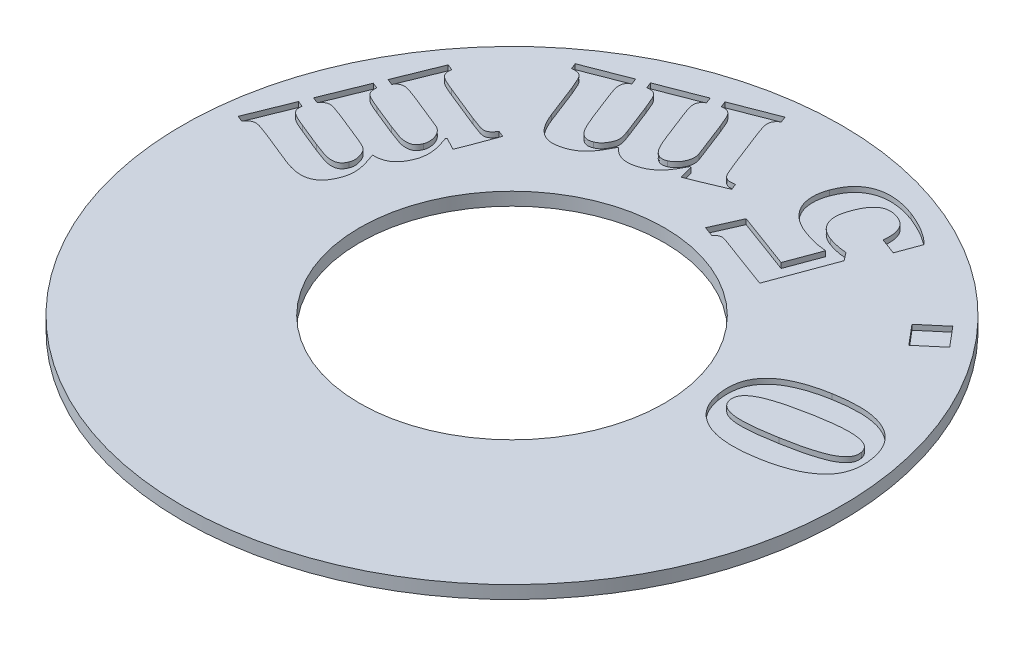
from build123d import *

# Parameters (mm, degrees)
SKETCH1_R           = 12.7
BOSS_EXTRUDE1_DEPTH = 0.5
SKETCH2_R           = 5.8674
CUT_EXTRUDE1_DEPTH  = 18.967470607
CUT_EXTRUDE2_DEPTH  = 0.2


with BuildPart() as part:
    # Sketch1 → Boss-Extrude1 (new body)
    with BuildSketch(Plane(origin=(0, 0, 0), x_dir=(1, 0, 0), z_dir=(0, 1, 0))):
        with Locations(Location((0, 0, 0), (0, 0, 270))):
            Circle(SKETCH1_R)
    extrude(amount=BOSS_EXTRUDE1_DEPTH)

    # Sketch2 → Cut-Extrude1 (cut, through all)
    with BuildSketch(Plane(origin=(0, 0, 0), x_dir=(-1, 0, 0), z_dir=(0, -1, 0))):
        with Locations(Location((0, 0, 0), (0, 0, 90))):
            Circle(SKETCH2_R)
    extrude(amount=-CUT_EXTRUDE1_DEPTH, mode=Mode.SUBTRACT)

    # Sketch4 → Cut-Extrude2 (cut)
    # profile 1 of 5: a face of its own
    with BuildSketch(Plane(origin=(0, 0.5, 0), x_dir=(1, 0, 0), z_dir=(0, 1, 0))):
        with BuildLine():
            add(Edge.make_bspline(
                [(11.714406882, 2.179505208), (11.721984598, 2.132914268), (11.736908331, 2.041156981), (11.74866318, 1.904864997), (11.752357826, 1.773036451), (11.746695803, 1.645600384), (11.733179819, 1.522296204), (11.707876126, 1.403581433), (11.676714797, 1.28899405), (11.635405668, 1.178658558), (11.584646929, 1.072709619), (11.523881673, 0.970485095), (11.450986751, 0.873052683), (11.368678714, 0.778083972), (11.274465946, 0.687951638), (11.170133167, 0.601476878), (11.055210203, 0.519203927), (10.930428021, 0.43948966), (10.794467406, 0.364166051), (10.646314632, 0.29538558), (10.487102545, 0.230047996), (10.316218188, 0.16993316), (10.134333462, 0.113455876), (9.940675548, 0.063162279), (9.735895278, 0.016742244), (9.594894738, -0.009651177), (9.522774937, -0.023151042)],
                knots=[0, 0, 0, 0, 0.958609587, 1.887908131, 2.776528707, 3.635817958, 4.477514347, 5.292981102, 6.098962166, 6.887927691, 7.682593858, 8.482745968, 9.299441865, 10.151273195, 11.03293693, 11.944771076, 12.90195535, 13.902185533, 14.951360626, 16.056714254, 17.218407893, 18.446172401, 19.735398079, 21.086155649, 22.509609453, 24, 24, 24, 24], degree=3))
            add(Edge.make_bspline(
                [(9.522774937, -0.023151042), (9.454127441, -0.034645174), (9.319705933, -0.05715231), (9.12075356, -0.082313288), (8.928870131, -0.100575903), (8.743451731, -0.10917171), (8.565078925, -0.110415714), (8.393576185, -0.104321059), (8.229124035, -0.088644407), (8.071591119, -0.065721648), (7.920831055, -0.035182887), (7.778159776, 0.00463669), (7.642571789, 0.051083117), (7.514219242, 0.104586405), (7.394291447, 0.168004545), (7.280576129, 0.23747752), (7.175347658, 0.315612752), (7.077398468, 0.400919375), (6.98835329, 0.493963148), (6.905829407, 0.592845125), (6.834554273, 0.700823489), (6.770493783, 0.814664857), (6.713621981, 0.934727323), (6.668112162, 1.062488935), (6.628452618, 1.196237051), (6.610486777, 1.288925244), (6.601333965, 1.336145833)],
                knots=[0, 0, 0, 0, 1.377081801, 2.696520979, 3.967029936, 5.189958886, 6.367899492, 7.495764028, 8.58392972, 9.634848915, 10.644458858, 11.625276047, 12.563445176, 13.479055366, 14.373430196, 15.245143787, 16.113332587, 16.963553947, 17.81203241, 18.65923255, 19.508240485, 20.36773861, 21.24275135, 22.132948981, 23.048818972, 24, 24, 24, 24], degree=3))
            add(Edge.make_bspline(
                [(6.601333965, 1.336145833), (6.590374917, 1.409119309), (6.569088165, 1.550862297), (6.561219532, 1.760415475), (6.575293668, 1.958953541), (6.610358421, 2.147139956), (6.667456922, 2.324628611), (6.748320425, 2.490485464), (6.849085657, 2.646203705), (6.972869034, 2.79037078), (7.119030215, 2.923495287), (7.287908697, 3.046015147), (7.479575957, 3.15799777), (7.692999529, 3.260534562), (7.929473846, 3.351911703), (8.188606749, 3.432493305), (8.469955143, 3.504792325), (8.666309681, 3.541772454), (8.767610007, 3.560850694)],
                knots=[0, 0, 0, 0, 0.999567856, 1.941551137, 2.835430862, 3.692112604, 4.530042397, 5.354256606, 6.185901446, 7.037296772, 7.922125271, 8.859554852, 9.859817352, 10.926857119, 12.065428116, 13.292532894, 14.603203662, 16, 16, 16, 16], degree=3))
            add(Edge.make_bspline(
                [(8.767610007, 3.560850694), (8.872556173, 3.578089573), (9.075950462, 3.611499934), (9.374044021, 3.642534882), (9.654962104, 3.655480481), (9.919104507, 3.649083388), (10.16646075, 3.625396611), (10.396947804, 3.584262386), (10.610223933, 3.523655106), (10.806244942, 3.444326865), (10.984715177, 3.347232526), (11.145299598, 3.232771229), (11.287704723, 3.100868546), (11.410870941, 2.950264084), (11.516398778, 2.782666511), (11.602055143, 2.597212453), (11.670170403, 2.3949462), (11.699387738, 2.252651608), (11.714406882, 2.179505208)],
                knots=[0, 0, 0, 0, 1.382354807, 2.679117153, 3.893664334, 5.035775843, 6.111018257, 7.121123013, 8.075237234, 8.98808331, 9.864605882, 10.710386895, 11.545304963, 12.380236698, 13.232482408, 14.113005489, 15.02999227, 16, 16, 16, 16], degree=3))
        make_face()
        with BuildLine():
            add(Edge.make_bspline(
                [(9.219606535, 1.068255208), (9.284683323, 1.079829663), (9.411704072, 1.102421373), (9.596640597, 1.138497503), (9.770534016, 1.176660884), (9.934053566, 1.212252427), (10.086559049, 1.249921426), (10.228376129, 1.288387015), (10.35990895, 1.327142151), (10.481497289, 1.365270741), (10.593486227, 1.40541221), (10.697010143, 1.445743704), (10.79215177, 1.48792763), (10.87901414, 1.530180936), (10.957341787, 1.574928103), (11.027127581, 1.620793229), (11.089596263, 1.666885144), (11.158879658, 1.728964171), (11.22971171, 1.810928632), (11.284648099, 1.922689244), (11.309871915, 2.043155021), (11.300339469, 2.123992073), (11.295483271, 2.165173611)],
                knots=[0, 0, 0, 0, 1.557617706, 3.040250939, 4.439806625, 5.752917555, 6.983694298, 8.141184335, 9.215338113, 10.214963335, 11.143493169, 12.018295842, 12.832493275, 13.595433329, 14.293601868, 14.956508562, 15.562688609, 16.120753321, 17.14746835, 18.092449204, 19.02821946, 20, 20, 20, 20], degree=3))
            add(Edge.make_bspline(
                [(11.295483271, 2.165173611), (11.290630428, 2.187423295), (11.281129519, 2.230983781), (11.255962542, 2.291754108), (11.225759764, 2.348181119), (11.184496682, 2.39690216), (11.137027399, 2.441883073), (11.0791213, 2.480383085), (11.013344364, 2.515872768), (10.937047568, 2.544976214), (10.851936991, 2.572052153), (10.75519068, 2.592541648), (10.647257078, 2.607613076), (10.527627319, 2.617369926), (10.395573233, 2.621273708), (10.249846914, 2.620975218), (10.090001592, 2.60947772), (9.916856706, 2.594438819), (9.731964111, 2.573380479), (9.53727306, 2.546553163), (9.33246291, 2.515932739), (9.193101759, 2.491778247), (9.121490215, 2.479366319)],
                knots=[0, 0, 0, 0, 0.572229672, 1.120312679, 1.650532829, 2.176538382, 2.719915381, 3.292219849, 3.921383417, 4.598328246, 5.344567867, 6.168499634, 7.084441038, 8.087164471, 9.188822549, 10.410175109, 11.7543557, 13.221963368, 14.786276719, 16.438938668, 18.170127758, 20, 20, 20, 20], degree=3))
            add(Edge.make_bspline(
                [(9.121490215, 2.479366319), (9.017037789, 2.459976007), (8.816564112, 2.422760526), (8.530215213, 2.362148612), (8.270747284, 2.301187922), (8.038791019, 2.23725447), (7.833636719, 2.172384552), (7.654402583, 2.108053279), (7.501513369, 2.042603377), (7.374408119, 1.975163143), (7.26992064, 1.906849976), (7.183532145, 1.838824888), (7.115875961, 1.768140381), (7.064031908, 1.69661103), (7.030638119, 1.621986877), (7.010354212, 1.545727996), (7.002907456, 1.466434944), (7.010030296, 1.413636803), (7.013642993, 1.386857639)],
                knots=[0, 0, 0, 0, 1.988775594, 3.817021521, 5.4789669, 6.977745736, 8.32016058, 9.506246951, 10.541465291, 11.430941948, 12.196080763, 12.876175374, 13.484416021, 14.022644376, 14.521394553, 15.005310829, 15.495494642, 16, 16, 16, 16], degree=3))
            add(Edge.make_bspline(
                [(7.013642993, 1.386857639), (7.020973001, 1.355992341), (7.03519293, 1.29611487), (7.075179093, 1.213190212), (7.129685771, 1.140706797), (7.200039193, 1.078925458), (7.285376056, 1.02810536), (7.385532945, 0.987763871), (7.500413136, 0.957375034), (7.629962099, 0.935883122), (7.775133078, 0.922664936), (7.93566621, 0.920645981), (8.111495262, 0.92477074), (8.302288999, 0.938796755), (8.508870696, 0.959906252), (8.731603074, 0.988816652), (8.970430894, 1.025365971), (9.134764463, 1.053651808), (9.219606535, 1.068255208)],
                knots=[0, 0, 0, 0, 0.626844687, 1.216054204, 1.808491308, 2.41169403, 3.058255876, 3.766476537, 4.543323699, 5.407210063, 6.364629713, 7.427452982, 8.585033063, 9.847165452, 11.215172558, 12.697471874, 14.294972063, 16, 16, 16, 16], degree=3))
        make_face(mode=Mode.SUBTRACT)
    # profile 2 of 5: a face of its own
    with BuildSketch(Plane(origin=(0, 0.5, 0), x_dir=(1, 0, 0), z_dir=(0, 1, 0))):
        Polygon((7.998334498, 7.413598887), (8.851615748, 8.134588471), (9.493230331, 7.375013818), (8.639949081, 6.654024235), align=None)
    # profile 3 of 5: a face of its own
    with BuildSketch(Plane(origin=(0, 0.5, 0), x_dir=(1, 0, 0), z_dir=(0, 1, 0))):
        with BuildLine():
            Line((5.574896811, 10.308708524), (5.254089519, 9.438890816))
            Line((5.254089519, 9.438890816), (4.624601672, 9.672606094))
            add(Edge.make_bspline(
                [(4.624601672, 9.672606094), (4.631387567, 9.737942532), (4.644258636, 9.861868691), (4.637340573, 10.040064116), (4.611721198, 10.199778948), (4.560455455, 10.340509304), (4.486390823, 10.462510654), (4.389225928, 10.565932844), (4.269388176, 10.651487965), (4.177198854, 10.690074646), (4.129610353, 10.709993246)],
                knots=[0, 0, 0, 0, 1.252087754, 2.37488346, 3.392886558, 4.326924804, 5.214503496, 6.097638712, 7.017993396, 8, 8, 8, 8], degree=3))
            add(Edge.make_bspline(
                [(4.129610353, 10.709993246), (4.098901443, 10.72044862), (4.038896756, 10.740878242), (3.948868043, 10.761728287), (3.862071012, 10.773376114), (3.778872751, 10.77419959), (3.699158905, 10.767154906), (3.622875935, 10.748924048), (3.549977688, 10.721659066), (3.480655486, 10.683136114), (3.414711854, 10.635505347), (3.35086418, 10.578828583), (3.291686432, 10.510651358), (3.234383561, 10.433147177), (3.178789408, 10.345815477), (3.128102715, 10.24739301), (3.077409419, 10.140176671), (3.048678803, 10.06383279), (3.03379438, 10.024281441)],
                knots=[0, 0, 0, 0, 1.049979466, 2.051641988, 2.987448877, 3.880037529, 4.740886302, 5.572193246, 6.412058797, 7.253524656, 8.131960202, 9.042144691, 10.011621459, 11.049323214, 12.161905286, 13.359627819, 14.632106724, 16, 16, 16, 16], degree=3))
            add(Edge.make_bspline(
                [(3.03379438, 10.024281441), (3.019988553, 9.984771964), (2.993269696, 9.908308016), (2.963679972, 9.793593111), (2.941875045, 9.684020754), (2.931992764, 9.578025516), (2.931638403, 9.476852983), (2.941653119, 9.379675485), (2.9611446, 9.287096326), (2.991388586, 9.199138012), (3.030624167, 9.116147643), (3.081492517, 9.039624557), (3.139875889, 8.967296797), (3.208480709, 8.901174761), (3.286972074, 8.841340457), (3.373734714, 8.786177956), (3.470821046, 8.737534397), (3.539591979, 8.71004246), (3.575087783, 8.695852621)],
                knots=[0, 0, 0, 0, 1.226162231, 2.373030824, 3.469373376, 4.497174898, 5.48808273, 6.430137497, 7.355418433, 8.254629872, 9.150674949, 10.037937929, 10.941268307, 11.870552641, 12.82277354, 13.829765479, 14.87984332, 16, 16, 16, 16], degree=3))
            add(Edge.make_bspline(
                [(3.575087783, 8.695852621), (3.634660591, 8.675253181), (3.758475735, 8.632439643), (3.952102812, 8.589705806), (4.144627613, 8.556713866), (4.271367423, 8.544151157), (4.331355144, 8.538205052)],
                knots=[0, 0, 0, 0, 0.975653588, 2.02778234, 3.066521846, 4, 4, 4, 4], degree=3))
            Line((4.331355144, 8.538205052), (4.571685005, 8.227319635))
            Line((4.571685005, 8.227319635), (3.693047853, 5.851581788))
            Line((3.693047853, 5.851581788), (1.637014866, 6.612258871))
            add(Edge.make_bspline(
                [(1.637014866, 6.612258871), (1.616830245, 6.619313332), (1.579201403, 6.632464492), (1.526968323, 6.649546043), (1.481937633, 6.659966101), (1.433987476, 6.665787092), (1.380020191, 6.66387918), (1.330027678, 6.646510522), (1.29131885, 6.622255393), (1.258434576, 6.595218189), (1.221340263, 6.560128354), (1.196244375, 6.533046192), (1.182813478, 6.518552274)],
                knots=[0, 0, 0, 0, 1.253494046, 2.336805197, 3.220012507, 3.95747953, 5.165541251, 6.3509189, 7.00855668, 7.83615953, 8.841948909, 10, 10, 10, 10], degree=3))
            Line((1.182813478, 6.518552274), (0.800270075, 6.660765816))
            Line((0.800270075, 6.660765816), (1.279827366, 7.744455052))
            Line((1.279827366, 7.744455052), (3.416337783, 6.954012344))
            Line((3.416337783, 6.954012344), (3.880461047, 8.206373455))
            add(Edge.make_bspline(
                [(3.880461047, 8.206373455), (3.803522357, 8.213312916), (3.648813276, 8.227266854), (3.45543269, 8.262445033), (3.29601422, 8.302888221), (3.165244012, 8.339961342), (3.0234968, 8.386881328), (2.926024573, 8.422540568), (2.87504438, 8.441191163)],
                knots=[0, 0, 0, 0, 1.341269289, 2.697037574, 3.40753922, 4.197423952, 5.057211692, 6, 6, 6, 6], degree=3))
            add(Edge.make_bspline(
                [(2.87504438, 8.441191163), (2.806008698, 8.468730307), (2.671373454, 8.522437886), (2.48571203, 8.625979715), (2.319487782, 8.742871718), (2.175288875, 8.875907922), (2.053429011, 9.021833226), (1.957424292, 9.181291156), (1.884371252, 9.350819162), (1.840041077, 9.532181134), (1.819062593, 9.721085121), (1.830024493, 9.915670826), (1.862866112, 10.115632746), (1.90736191, 10.246016871), (1.930261394, 10.313118246)],
                knots=[0, 0, 0, 0, 1.128832902, 2.201480293, 3.222928609, 4.211197018, 5.175316162, 6.102663331, 7.031254653, 7.970138723, 8.930626153, 9.909201145, 10.923983423, 12, 12, 12, 12], degree=3))
            add(Edge.make_bspline(
                [(1.930261394, 10.313118246), (1.94559186, 10.352269578), (1.975609559, 10.428929537), (2.027687036, 10.538232056), (2.084130342, 10.64035564), (2.145134968, 10.735386069), (2.213764382, 10.82149829), (2.284294623, 10.902277804), (2.361510413, 10.974442059), (2.442800167, 11.039593247), (2.529429522, 11.096951368), (2.619555555, 11.147764157), (2.714368105, 11.191149212), (2.812820072, 11.22712116), (2.915529272, 11.256369019), (3.022148124, 11.277009639), (3.13308148, 11.289945675), (3.288001447, 11.299146839), (3.491355399, 11.289925868), (3.744705188, 11.254546034), (4.010669123, 11.189738457), (4.188521435, 11.12788308), (4.280643339, 11.095843941)],
                knots=[0, 0, 0, 0, 0.895391496, 1.753214336, 2.576597175, 3.37990413, 4.154990145, 4.920091058, 5.66210029, 6.402911233, 7.136700113, 7.872656764, 8.604690066, 9.355033743, 10.103374157, 10.877075559, 11.665446707, 12.480866022, 14.180599257, 15.990525543, 17.923218344, 20, 20, 20, 20], degree=3))
            add(Edge.make_bspline(
                [(4.280643339, 11.095843941), (4.341594005, 11.072715612), (4.464212067, 11.026186983), (4.643578069, 10.942026547), (4.822735187, 10.850900287), (4.997684924, 10.750565467), (5.164616911, 10.645565767), (5.317141244, 10.53639273), (5.453574886, 10.425289374), (5.535328424, 10.346730639), (5.574896811, 10.308708524)],
                knots=[0, 0, 0, 0, 1.025349981, 2.062757216, 3.115184705, 4.187311912, 5.234724667, 6.216692077, 7.136886078, 8, 8, 8, 8], degree=3))
        make_face()
    # profile 4 of 5: a face of its own
    with BuildSketch(Plane(origin=(0, 0.5, 0), x_dir=(1, 0, 0), z_dir=(0, 1, 0))):
        with BuildLine():
            Line((-1.500499582, 8.398806621), (-1.545699235, 8.394396899))
            add(Edge.make_bspline(
                [(-1.545699235, 8.394396899), (-1.578680129, 8.328177935), (-1.64156419, 8.201919461), (-1.744030648, 8.02884167), (-1.846044886, 7.880084841), (-1.949946333, 7.754727011), (-2.05857315, 7.650318657), (-2.17357881, 7.562688436), (-2.294646542, 7.48709386), (-2.38188138, 7.450331118), (-2.425438818, 7.431975024)],
                knots=[0, 0, 0, 0, 1.327248858, 2.530640849, 3.606312378, 4.561298934, 5.447501221, 6.30354898, 7.15294094, 8, 8, 8, 8], degree=3))
            add(Edge.make_bspline(
                [(-2.425438818, 7.431975024), (-2.466711164, 7.416501822), (-2.546064862, 7.386751738), (-2.664025189, 7.356362389), (-2.774202536, 7.336715383), (-2.877415506, 7.329477021), (-2.975012839, 7.335492968), (-3.068194376, 7.350780271), (-3.158059284, 7.376341345), (-3.244768044, 7.411813357), (-3.328951411, 7.458526601), (-3.408552551, 7.519497131), (-3.489562903, 7.588502591), (-3.538054885, 7.643001758), (-3.563147151, 7.671202454)],
                knots=[0, 0, 0, 0, 1.261849166, 2.426137807, 3.483538902, 4.464561663, 5.381899843, 6.278343648, 7.164718223, 8.052217243, 8.957088943, 9.91293841, 10.920046081, 12, 12, 12, 12], degree=3))
            add(Edge.make_bspline(
                [(-3.563147151, 7.671202454), (-3.599531182, 7.59843004), (-3.668389116, 7.460705936), (-3.777147706, 7.27123298), (-3.885029972, 7.111206789), (-3.99057811, 6.976050247), (-4.102053829, 6.86480688), (-4.219976724, 6.770641123), (-4.348199055, 6.69203994), (-4.439779694, 6.652578048), (-4.485881526, 6.632712871)],
                knots=[0, 0, 0, 0, 1.370148351, 2.593049264, 3.676206861, 4.618613109, 5.476374145, 6.322127868, 7.155356622, 8, 8, 8, 8], degree=3))
            add(Edge.make_bspline(
                [(-4.485881526, 6.632712871), (-4.530445251, 6.616076964), (-4.615952839, 6.584156465), (-4.743101562, 6.551526654), (-4.861772979, 6.530294812), (-4.973189572, 6.524827778), (-5.078684173, 6.531644554), (-5.178538203, 6.555233414), (-5.275449977, 6.587065021), (-5.366578661, 6.635862424), (-5.452894115, 6.696968271), (-5.534744327, 6.770753064), (-5.613569564, 6.855921676), (-5.687290851, 6.95508305), (-5.757960734, 7.067347228), (-5.826043906, 7.19293182), (-5.891036555, 7.332819596), (-5.93122393, 7.431428083), (-5.952114165, 7.482686829)],
                knots=[0, 0, 0, 0, 1.164238848, 2.233907847, 3.210467445, 4.111618036, 4.95998529, 5.789768502, 6.618037198, 7.451375979, 8.310370773, 9.20280479, 10.145472204, 11.148103074, 12.224265042, 13.392220349, 14.64442181, 16, 16, 16, 16], degree=3))
            Line((-5.952114165, 7.482686829), (-6.443798193, 8.752686829))
            add(Edge.make_bspline(
                [(-6.443798193, 8.752686829), (-6.46298886, 8.80204742), (-6.500138469, 8.897600464), (-6.557518406, 9.031550001), (-6.610596713, 9.14701544), (-6.6652213, 9.236719574), (-6.719195792, 9.30301382), (-6.776882541, 9.349899558), (-6.841998121, 9.381410269), (-6.91741995, 9.396764093), (-7.003583166, 9.400735532), (-7.06413052, 9.395102303), (-7.096437082, 9.392096552)],
                knots=[0, 0, 0, 0, 1.559140996, 3.018210822, 4.290952874, 5.296787436, 6.103062558, 6.795868098, 7.468525882, 8.211398264, 9.045646607, 10, 10, 10, 10], degree=3))
            Line((-7.096437082, 9.392096552), (-7.185733957, 9.621402107))
            Line((-7.185733957, 9.621402107), (-5.508937082, 10.271836135))
            Line((-5.508937082, 10.271836135), (-5.419640207, 10.042530579))
            add(Edge.make_bspline(
                [(-5.419640207, 10.042530579), (-5.44126826, 10.026399982), (-5.481650493, 9.996282175), (-5.533846741, 9.947929725), (-5.570951767, 9.898212078), (-5.594627254, 9.847372575), (-5.604920024, 9.794555745), (-5.609329846, 9.738344691), (-5.607052869, 9.676900081), (-5.596124222, 9.607106489), (-5.574701737, 9.523170129), (-5.540686924, 9.418742082), (-5.495430219, 9.289738424), (-5.459929128, 9.196145913), (-5.440586387, 9.145152107)],
                knots=[0, 0, 0, 0, 0.976263073, 1.822803084, 2.564919562, 3.207680077, 3.833713685, 4.500778585, 5.245986733, 6.052842077, 7.052732165, 8.377616694, 10.026347317, 12, 12, 12, 12], degree=3))
            Line((-5.440586387, 9.145152107), (-5.077886735, 8.212495857))
            add(Edge.make_bspline(
                [(-5.077886735, 8.212495857), (-5.058213378, 8.162818328), (-5.020773209, 8.068277516), (-4.964958774, 7.935032266), (-4.911566849, 7.817607376), (-4.862407323, 7.714442109), (-4.814206633, 7.625009471), (-4.764214553, 7.549826783), (-4.714948421, 7.485912263), (-4.663879121, 7.434812521), (-4.612373766, 7.394089192), (-4.560879865, 7.363706829), (-4.510177119, 7.340304693), (-4.45834347, 7.326789669), (-4.404290481, 7.322415505), (-4.347102358, 7.327322637), (-4.286499427, 7.340839251), (-4.245784961, 7.355102318), (-4.224605485, 7.362521899)],
                knots=[0, 0, 0, 0, 1.886072366, 3.589365554, 5.098767554, 6.438935382, 7.62327005, 8.680997452, 9.623029443, 10.466885591, 11.224590498, 11.934248244, 12.573028465, 13.189694188, 13.814492117, 14.478078476, 15.208303495, 16, 16, 16, 16], degree=3))
            add(Edge.make_bspline(
                [(-4.224605485, 7.362521899), (-4.196124879, 7.375107043), (-4.140617846, 7.399634753), (-4.06647594, 7.453951996), (-4.002096369, 7.521299194), (-3.946506985, 7.600529328), (-3.897145713, 7.683379182), (-3.857845601, 7.766968153), (-3.829112457, 7.850147785), (-3.819086508, 7.936966256), (-3.820853325, 8.026934807), (-3.836167036, 8.105507556), (-3.855045624, 8.176985637), (-3.877649694, 8.244743013), (-3.906253353, 8.326857924), (-3.92895999, 8.385647919), (-3.941280832, 8.41754794)],
                knots=[0, 0, 0, 0, 1.05712718, 2.060278967, 3.103930472, 4.214663213, 5.347149753, 6.382223774, 7.355140304, 8.326206341, 9.339519046, 10.406659634, 11.040664636, 11.855394827, 12.836316401, 14, 14, 14, 14], degree=3))
            Line((-3.941280832, 8.41754794), (-4.381150624, 9.551948982))
            add(Edge.make_bspline(
                [(-4.381150624, 9.551948982), (-4.395843684, 9.589066049), (-4.42322045, 9.65822422), (-4.461713942, 9.755215287), (-4.496936471, 9.837422587), (-4.535923805, 9.924848545), (-4.581174005, 10.013011645), (-4.639853073, 10.097027896), (-4.70584835, 10.158300648), (-4.770957186, 10.189348355), (-4.82925529, 10.203846904), (-4.881158179, 10.209027832), (-4.940539071, 10.208514609), (-4.982726237, 10.205229651), (-5.005126318, 10.20348544)],
                knots=[0, 0, 0, 0, 1.43593228, 2.675492938, 3.753329024, 4.652559938, 6.11901344, 7.311444819, 8.322447917, 9.321542641, 9.866545793, 10.478167495, 11.191953967, 12, 12, 12, 12], degree=3))
            Line((-5.005126318, 10.20348544), (-5.094423193, 10.432790996))
            Line((-5.094423193, 10.432790996), (-3.438572499, 11.074405579))
            Line((-3.438572499, 11.074405579), (-3.349275624, 10.845100024))
            add(Edge.make_bspline(
                [(-3.349275624, 10.845100024), (-3.371829284, 10.829185098), (-3.413734166, 10.799615038), (-3.465251913, 10.749034653), (-3.503876703, 10.69980329), (-3.528520914, 10.648919497), (-3.540482433, 10.595811986), (-3.544340482, 10.539416273), (-3.542185737, 10.47838512), (-3.531505961, 10.409501208), (-3.508063178, 10.326746257), (-3.474739068, 10.222065038), (-3.429638126, 10.092106636), (-3.393324208, 9.997946719), (-3.373529096, 9.946619121)],
                knots=[0, 0, 0, 0, 0.992957471, 1.844922954, 2.591631667, 3.237113429, 3.86329802, 4.54058269, 5.269232777, 6.059395145, 7.045266299, 8.364235463, 10.018105088, 12, 12, 12, 12], degree=3))
            Line((-3.373529096, 9.946619121), (-3.010829443, 9.013962871))
            add(Edge.make_bspline(
                [(-3.010829443, 9.013962871), (-2.996657788, 8.977151092), (-2.969516159, 8.906648973), (-2.928004225, 8.806398578), (-2.891454916, 8.714556702), (-2.844654724, 8.610739499), (-2.791764113, 8.500780224), (-2.730333993, 8.390242101), (-2.666711658, 8.305624809), (-2.604799685, 8.236574129), (-2.538315851, 8.186697449), (-2.473039115, 8.148601797), (-2.403922676, 8.128561555), (-2.329787806, 8.121444181), (-2.246708712, 8.132336889), (-2.1910254, 8.152150967), (-2.160855485, 8.162886482)],
                knots=[0, 0, 0, 0, 1.218376668, 2.33344156, 3.351562828, 4.271279059, 5.850097088, 7.121466675, 8.168044415, 9.115705124, 9.973893436, 10.725810247, 11.436861629, 12.177817345, 13.012718608, 14, 14, 14, 14], degree=3))
            add(Edge.make_bspline(
                [(-2.160855485, 8.162886482), (-2.139651487, 8.17267279), (-2.096037015, 8.192802233), (-2.034047516, 8.233544001), (-1.97680789, 8.28717359), (-1.920611109, 8.347803533), (-1.870920225, 8.417558281), (-1.828079155, 8.49341736), (-1.795216046, 8.575437602), (-1.771331247, 8.661942034), (-1.756280888, 8.749896331), (-1.755281747, 8.83758026), (-1.766801807, 8.92340652), (-1.78547311, 8.977820506), (-1.79484854, 9.005143427)],
                knots=[0, 0, 0, 0, 0.836243377, 1.720067758, 2.64304706, 3.640427864, 4.67827718, 5.704026804, 6.755486752, 7.835339964, 8.915594534, 9.942780013, 10.967007125, 12, 12, 12, 12], degree=3))
            Line((-1.79484854, 9.005143427), (-2.317400624, 10.352313565))
            add(Edge.make_bspline(
                [(-2.317400624, 10.352313565), (-2.337449883, 10.40272207), (-2.374297839, 10.495366407), (-2.426816724, 10.620893065), (-2.471793057, 10.720796935), (-2.510807835, 10.798084427), (-2.54947846, 10.857414013), (-2.587241421, 10.906814316), (-2.629873376, 10.945553523), (-2.675175925, 10.977219168), (-2.728120542, 10.998709343), (-2.789785301, 11.010093904), (-2.861054931, 11.0134522), (-2.911278956, 11.00790917), (-2.938069026, 11.004952454)],
                knots=[0, 0, 0, 0, 1.95560344, 3.594147164, 4.904245662, 5.905587673, 6.710271926, 7.455046029, 8.139409163, 8.778697916, 9.437986146, 10.180991047, 11.02971977, 12, 12, 12, 12], degree=3))
            Line((-2.938069026, 11.004952454), (-3.027365901, 11.23425801))
            Line((-3.027365901, 11.23425801), (-1.360490901, 11.880282315))
            Line((-1.360490901, 11.880282315), (-1.271194026, 11.65097676))
            add(Edge.make_bspline(
                [(-1.271194026, 11.65097676), (-1.294464177, 11.633544837), (-1.337723243, 11.601139), (-1.391337788, 11.547318124), (-1.431986317, 11.49598486), (-1.45922466, 11.443955182), (-1.473163029, 11.3904295), (-1.479948266, 11.334042404), (-1.478351478, 11.2732882), (-1.469043519, 11.204391579), (-1.446753676, 11.121913989), (-1.414774149, 11.018105936), (-1.368617134, 10.890236847), (-1.333428141, 10.796908086), (-1.314188818, 10.745881274)],
                knots=[0, 0, 0, 0, 1.037135948, 1.928029266, 2.705015774, 3.368269828, 4.008263075, 4.669175765, 5.391120458, 6.172527977, 7.146544743, 8.437585155, 10.052275959, 12, 12, 12, 12], degree=3))
            Line((-1.314188818, 10.745881274), (-0.759666249, 9.316028843))
            add(Edge.make_bspline(
                [(-0.759666249, 9.316028843), (-0.743921112, 9.275951927), (-0.714551879, 9.201196888), (-0.672985784, 9.097792191), (-0.636647661, 9.011772902), (-0.597587967, 8.923591054), (-0.551084166, 8.837162329), (-0.490114353, 8.754815403), (-0.417614899, 8.699473063), (-0.347881536, 8.672373402), (-0.282522669, 8.66399496), (-0.221567487, 8.665129956), (-0.1486079, 8.670552639), (-0.096688113, 8.678765615), (-0.06844229, 8.683233704)],
                knots=[0, 0, 0, 0, 1.450579982, 2.705751189, 3.754223165, 4.596399602, 5.953928095, 7.055990142, 8.019135306, 8.987042258, 9.536785458, 10.230042737, 11.037093544, 12, 12, 12, 12], degree=3))
            Line((-0.06844229, 8.683233704), (0.023059446, 8.446211135))
            Line((0.023059446, 8.446211135), (-0.919518679, 8.048233704))
            Line((-0.919518679, 8.048233704), (-1.35828604, 7.878459399))
            Line((-1.35828604, 7.878459399), (-1.500499582, 8.398806621))
        make_face()
    # profile 5 of 5: a face of its own
    with BuildSketch(Plane(origin=(0, 0.5, 0), x_dir=(1, 0, 0), z_dir=(0, 1, 0))):
        with BuildLine():
            Line((-7.16368149, 4.664663168), (-7.190139823, 4.626078099))
            add(Edge.make_bspline(
                [(-7.190139823, 4.626078099), (-7.164649314, 4.55729115), (-7.116159018, 4.42643855), (-7.060406274, 4.234988301), (-7.023567353, 4.059884896), (-7.00352064, 3.899037183), (-7.001186545, 3.748971413), (-7.014304824, 3.605121185), (-7.043445696, 3.465714205), (-7.075877359, 3.377062447), (-7.092023504, 3.332927057)],
                knots=[0, 0, 0, 0, 1.323655474, 2.517974168, 3.594956346, 4.550030047, 5.438835311, 6.298074595, 7.15269428, 8, 8, 8, 8], degree=3))
            add(Edge.make_bspline(
                [(-7.092023504, 3.332927057), (-7.109391964, 3.292567879), (-7.142627793, 3.215337616), (-7.200539997, 3.109008476), (-7.260487173, 3.015474937), (-7.326239511, 2.936063699), (-7.396981172, 2.869399843), (-7.470867554, 2.811013651), (-7.551013684, 2.763937143), (-7.6355474, 2.724328503), (-7.72676892, 2.695727303), (-7.825186481, 2.677359214), (-7.930758256, 2.667037872), (-8.00371313, 2.668508086), (-8.041216212, 2.669263863)],
                knots=[0, 0, 0, 0, 1.263710982, 2.418204165, 3.479912074, 4.456078823, 5.37604635, 6.272872525, 7.159668175, 8.044444074, 8.954083143, 9.901829511, 10.921417382, 12, 12, 12, 12], degree=3))
            add(Edge.make_bspline(
                [(-8.041216212, 2.669263863), (-8.012664087, 2.593533847), (-7.958672874, 2.450330655), (-7.897254148, 2.242338044), (-7.85254913, 2.055967161), (-7.828474389, 1.886937938), (-7.821582298, 1.730088367), (-7.835967702, 1.580047311), (-7.864362196, 1.433331711), (-7.898467654, 1.340098421), (-7.915539129, 1.293430529)],
                knots=[0, 0, 0, 0, 1.370034684, 2.590694547, 3.669965494, 4.612469718, 5.477980982, 6.321354364, 7.159754493, 8, 8, 8, 8], degree=3))
            add(Edge.make_bspline(
                [(-7.915539129, 1.293430529), (-7.933828094, 1.249679925), (-7.968937563, 1.165691549), (-8.032412777, 1.051173337), (-8.098127296, 0.950783898), (-8.169168421, 0.865612476), (-8.246420078, 0.79494002), (-8.330272364, 0.736809993), (-8.42075491, 0.690538837), (-8.517820011, 0.655949713), (-8.620881166, 0.634020694), (-8.730389366, 0.624589087), (-8.845983391, 0.625634916), (-8.968463093, 0.63949925), (-9.097654141, 0.665411655), (-9.234589546, 0.70270052), (-9.380766282, 0.748418167), (-9.479380765, 0.78714462), (-9.530599893, 0.807258654)],
                knots=[0, 0, 0, 0, 1.166157003, 2.238680671, 3.216885827, 4.115430327, 4.960405869, 5.785746922, 6.618928583, 7.454169059, 8.314444076, 9.204437564, 10.154049163, 11.15473713, 12.233078511, 13.393505669, 14.646219497, 16, 16, 16, 16], degree=3))
            Line((-9.530599893, 0.807258654), (-10.788473157, 1.315479141))
            add(Edge.make_bspline(
                [(-10.788473157, 1.315479141), (-10.837198309, 1.335365105), (-10.93189292, 1.374012366), (-11.068701722, 1.422278667), (-11.188218479, 1.464834061), (-11.290776005, 1.48467395), (-11.375475685, 1.492645704), (-11.448840067, 1.482828944), (-11.515458516, 1.455386455), (-11.577987731, 1.411308349), (-11.639513644, 1.351046656), (-11.676868623, 1.303475561), (-11.696875935, 1.277996502)],
                knots=[0, 0, 0, 0, 1.555345476, 3.022727044, 4.290413483, 5.298148995, 6.103883474, 6.795234541, 7.462966408, 8.213258407, 9.043021928, 10, 10, 10, 10], degree=3))
            Line((-11.696875935, 1.277996502), (-11.923976629, 1.369498238))
            Line((-11.923976629, 1.369498238), (-11.253698851, 3.029758654))
            Line((-11.253698851, 3.029758654), (-11.026598157, 2.938256918))
            add(Edge.make_bspline(
                [(-11.026598157, 2.938256918), (-11.029960338, 2.911836404), (-11.036252098, 2.862394837), (-11.033434767, 2.79240084), (-11.025049275, 2.7315848), (-11.004329165, 2.679830814), (-10.973648735, 2.635352947), (-10.936050485, 2.593698422), (-10.890161384, 2.553225869), (-10.831603216, 2.514464236), (-10.756009519, 2.472626088), (-10.656939665, 2.425799437), (-10.532508603, 2.370583843), (-10.439876693, 2.333428213), (-10.389393296, 2.313178793)],
                knots=[0, 0, 0, 0, 0.967159303, 1.809876639, 2.541800689, 3.189784498, 3.816452723, 4.498177879, 5.227655652, 6.036054599, 7.047658258, 8.369166658, 10.021234751, 12, 12, 12, 12], degree=3))
            Line((-10.389393296, 2.313178793), (-9.46555649, 1.939454835))
            add(Edge.make_bspline(
                [(-9.46555649, 1.939454835), (-9.416435453, 1.919663343), (-9.322668242, 1.881883337), (-9.18734965, 1.833023085), (-9.066048718, 1.790442387), (-8.957366929, 1.756626907), (-8.85942748, 1.732245359), (-8.77092797, 1.714460956), (-8.690667974, 1.707752382), (-8.618512686, 1.709648832), (-8.554126568, 1.719571665), (-8.496624311, 1.735804164), (-8.445991571, 1.758412537), (-8.400552882, 1.785931634), (-8.361171178, 1.822733924), (-8.32599669, 1.866972737), (-8.294662925, 1.920259699), (-8.277445532, 1.959460554), (-8.268316907, 1.980244766)],
                knots=[0, 0, 0, 0, 1.878070796, 3.585051825, 5.101820897, 6.437565254, 7.619771183, 8.680584427, 9.635205144, 10.469727393, 11.234690702, 11.940042337, 12.581845515, 13.196613156, 13.814687504, 14.482305303, 15.195321426, 16, 16, 16, 16], degree=3))
            add(Edge.make_bspline(
                [(-8.268316907, 1.980244766), (-8.257534085, 2.009689073), (-8.236657991, 2.066694758), (-8.226074912, 2.157529948), (-8.230994665, 2.250117387), (-8.250700093, 2.344292682), (-8.276670914, 2.436888028), (-8.311695876, 2.521512873), (-8.351553665, 2.599463038), (-8.407820039, 2.665553826), (-8.472844685, 2.726716651), (-8.540547921, 2.768619092), (-8.605705077, 2.80327289), (-8.670466534, 2.83379101), (-8.750396566, 2.86745152), (-8.808146459, 2.891940869), (-8.839375935, 2.905184002)],
                knots=[0, 0, 0, 0, 1.068599134, 2.068862603, 3.100116208, 4.22595035, 5.350943271, 6.381967343, 7.354395825, 8.327473133, 9.332143763, 10.394820174, 11.035447866, 11.855790058, 12.840473138, 14, 14, 14, 14], degree=3))
            Line((-8.839375935, 2.905184002), (-9.962752671, 3.35828296))
            add(Edge.make_bspline(
                [(-9.962752671, 3.35828296), (-9.999481899, 3.373023886), (-10.068383109, 3.400676729), (-10.165061628, 3.438750096), (-10.249327483, 3.467946945), (-10.339095588, 3.499841036), (-10.433888248, 3.52601606), (-10.534459602, 3.542625232), (-10.623541986, 3.535481123), (-10.690147393, 3.509446782), (-10.740536434, 3.476742951), (-10.779725654, 3.442190114), (-10.820605622, 3.398662829), (-10.847127756, 3.365825594), (-10.861233573, 3.348361085)],
                knots=[0, 0, 0, 0, 1.429321889, 2.681298033, 3.75164529, 4.649764094, 6.120981964, 7.299630989, 8.312490044, 9.308162915, 9.845594238, 10.476067727, 11.189495434, 12, 12, 12, 12], degree=3))
            Line((-10.861233573, 3.348361085), (-11.088334268, 3.439862821))
            Line((-11.088334268, 3.439862821), (-10.425773504, 5.080279488))
            Line((-10.425773504, 5.080279488), (-10.19867281, 4.988777752))
            add(Edge.make_bspline(
                [(-10.19867281, 4.988777752), (-10.201858239, 4.961631799), (-10.207829575, 4.910744589), (-10.207140856, 4.838805265), (-10.19770968, 4.776947141), (-10.179195994, 4.723726277), (-10.147745173, 4.679371037), (-10.110751365, 4.637502673), (-10.064112817, 4.598749239), (-10.007231392, 4.558889759), (-9.931144318, 4.519071238), (-9.831850867, 4.472892251), (-9.706557801, 4.417959586), (-9.613382351, 4.379993951), (-9.562570379, 4.359289904)],
                knots=[0, 0, 0, 0, 0.987883534, 1.851864852, 2.592561418, 3.244335589, 3.867287659, 4.544970173, 5.261422686, 6.054072821, 7.053245803, 8.36119061, 10.015624468, 12, 12, 12, 12], degree=3))
            Line((-9.562570379, 4.359289904), (-8.638733573, 3.985565946))
            add(Edge.make_bspline(
                [(-8.638733573, 3.985565946), (-8.602342555, 3.971263897), (-8.532163922, 3.943682962), (-8.431536164, 3.903593616), (-8.338625919, 3.869855838), (-8.254865153, 3.839254486), (-8.177711224, 3.815283931), (-8.10854483, 3.793931764), (-8.045439649, 3.778679486), (-7.973242446, 3.762009696), (-7.890103584, 3.754192271), (-7.798122086, 3.752138733), (-7.716619437, 3.766146747), (-7.644396396, 3.787554258), (-7.581824489, 3.822452219), (-7.527815945, 3.872981313), (-7.47918714, 3.939925785), (-7.455473942, 3.993794839), (-7.442596421, 4.023048585)],
                knots=[0, 0, 0, 0, 1.387864261, 2.676441114, 3.84430266, 4.896286497, 5.84090873, 6.711685298, 7.464586366, 8.145088478, 9.339168239, 10.421756988, 11.399564962, 12.261702271, 13.085184182, 13.916070177, 14.868315879, 16, 16, 16, 16], degree=3))
            add(Edge.make_bspline(
                [(-7.442596421, 4.023048585), (-7.43496743, 4.044919206), (-7.419227741, 4.090041396), (-7.407715803, 4.162997395), (-7.406061599, 4.241064556), (-7.412378632, 4.323228959), (-7.429301397, 4.406950483), (-7.453588567, 4.490709249), (-7.492720292, 4.569957367), (-7.537952794, 4.646781757), (-7.592295953, 4.717403188), (-7.656191247, 4.776941199), (-7.725579248, 4.828485114), (-7.77794394, 4.851542378), (-7.804193643, 4.863100668)],
                knots=[0, 0, 0, 0, 0.831538093, 1.715580859, 2.640822049, 3.634913423, 4.671387569, 5.707861716, 6.759882589, 7.838449821, 8.911500049, 9.948900108, 10.971811692, 12, 12, 12, 12], degree=3))
            Line((-7.804193643, 4.863100668), (-9.138134615, 5.401086779))
            add(Edge.make_bspline(
                [(-9.138134615, 5.401086779), (-9.188050424, 5.421074202), (-9.279847881, 5.457831985), (-9.406256666, 5.506115799), (-9.510320451, 5.539848629), (-9.593239892, 5.565490949), (-9.662819376, 5.578307527), (-9.724573607, 5.583112043), (-9.781839613, 5.580347901), (-9.836038739, 5.568236721), (-9.88708062, 5.543659273), (-9.938099964, 5.50749718), (-9.986725342, 5.455510501), (-10.01784493, 5.415676709), (-10.034410657, 5.394472196)],
                knots=[0, 0, 0, 0, 1.944520183, 3.576061564, 4.891378439, 5.900798065, 6.711411268, 7.444222383, 8.136385948, 8.777834455, 9.437737867, 10.171512257, 11.026650744, 12, 12, 12, 12], degree=3))
            Line((-10.034410657, 5.394472196), (-10.261511351, 5.485973932))
            Line((-10.261511351, 5.485973932), (-9.595643296, 7.136312474))
            Line((-9.595643296, 7.136312474), (-9.368542601, 7.044810738))
            add(Edge.make_bspline(
                [(-9.368542601, 7.044810738), (-9.371377434, 7.016182856), (-9.376677447, 6.962660086), (-9.374845864, 6.887080155), (-9.364481824, 6.822666159), (-9.345267593, 6.767911152), (-9.316385209, 6.721215277), (-9.278746054, 6.679352103), (-9.234893916, 6.638032809), (-9.178125407, 6.59847711), (-9.103069033, 6.558604484), (-9.005374757, 6.510925974), (-8.881286876, 6.456523365), (-8.789133837, 6.419115263), (-8.739054754, 6.398786432)],
                knots=[0, 0, 0, 0, 1.032008193, 1.929445479, 2.705864875, 3.365196111, 3.998682204, 4.662616387, 5.381423776, 6.157394763, 7.137598396, 8.429664271, 10.059758582, 12, 12, 12, 12], degree=3))
            Line((-8.739054754, 6.398786432), (-7.323533921, 5.826624974))
            add(Edge.make_bspline(
                [(-7.323533921, 5.826624974), (-7.283455897, 5.810885439), (-7.208825527, 5.781576425), (-7.105743516, 5.740070081), (-7.018376685, 5.708459099), (-6.928347946, 5.67629474), (-6.834051545, 5.652761921), (-6.733429259, 5.640089928), (-6.644636858, 5.65531928), (-6.577611837, 5.686760257), (-6.527150853, 5.728274843), (-6.484749045, 5.772335649), (-6.439430038, 5.829706804), (-6.409372189, 5.872750724), (-6.393082532, 5.896078099)],
                knots=[0, 0, 0, 0, 1.459074035, 2.716981125, 3.764881563, 4.607585066, 5.954541503, 7.054843656, 8.014947017, 8.967348348, 9.525474058, 10.221121103, 11.035948067, 12, 12, 12, 12], degree=3))
            Line((-6.393082532, 5.896078099), (-6.159367254, 5.801269071))
            Line((-6.159367254, 5.801269071), (-6.513247462, 4.84656421))
            Line((-6.513247462, 4.84656421), (-6.688533921, 4.412206571))
            Line((-6.688533921, 4.412206571), (-7.16368149, 4.664663168))
        make_face()
    extrude(amount=-CUT_EXTRUDE2_DEPTH, mode=Mode.SUBTRACT)


solid = part.part
